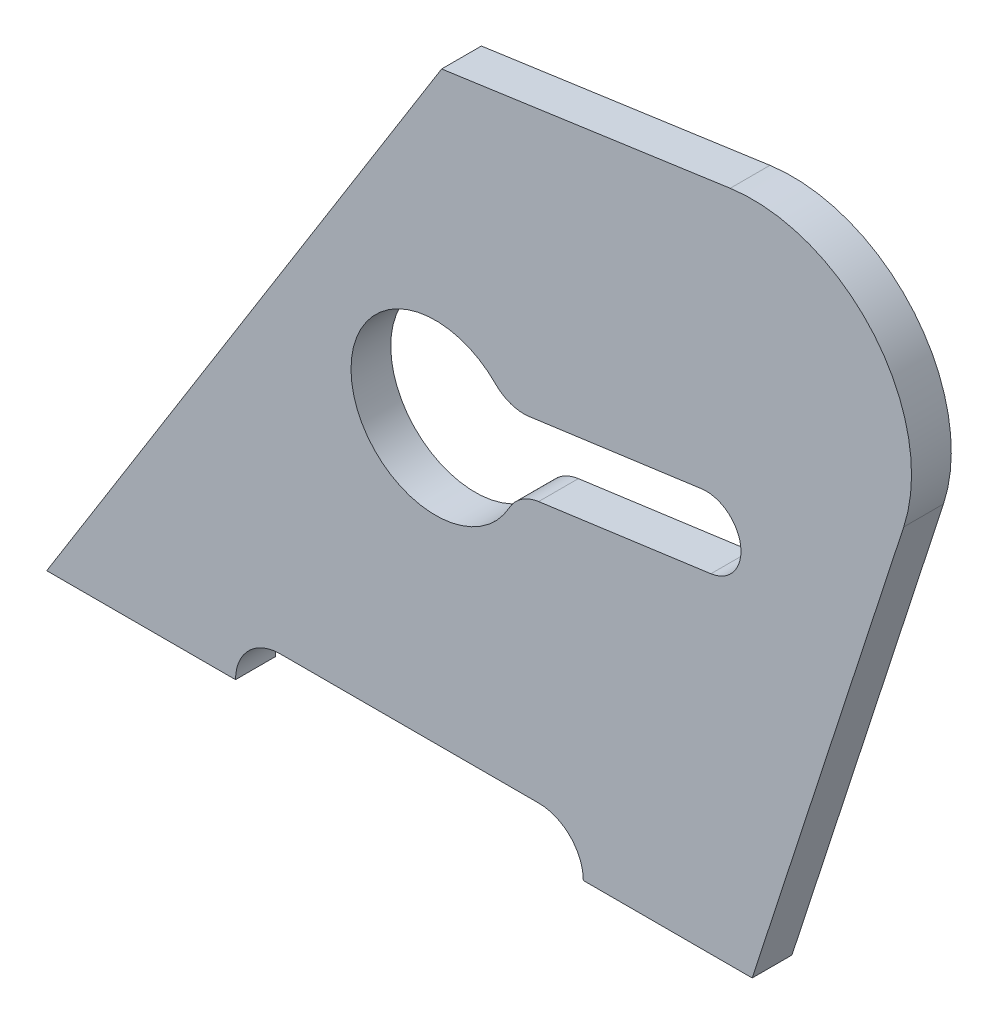
from build123d import *

# Parameters (mm, degrees)
BOSS_EXTRUDE1_DEPTH = 8


with BuildPart() as part:
    # Sketch1 → Boss-Extrude1 (new body)
    with BuildSketch(Plane.XY):
        with BuildLine():
            Line((0, 0), (79.487889635, 127.207214423))
            Line((79.487889635, 127.207214423), (137.573015724, 135.451290736))
            ThreePointArc((137.573015724, 135.451290736), (166.569139078, 124.354715336), (172.50354814, 93.880267937))
            Line((172.50354814, 93.880267937), (142, 0))
            Line((142, 0), (108, 0))
            ThreePointArc((108, 0), (105.363961031, 6.363961031), (99, 9))
            Line((99, 9), (47, 9))
            ThreePointArc((47, 9), (40.636038969, 6.363961031), (38, 0))
            Line((38, 0), (0, 0))
        make_face()
        with BuildLine():
            Line((97.109133521, 75.428206388), (131.785075785, 80.179945877))
            ThreePointArc((131.785075785, 80.179945877), (139.670612135, 74.195105322), (133.68577158, 66.309568971))
            Line((133.68577158, 66.309568971), (99.009829317, 61.557829483))
            ThreePointArc((99.009829317, 61.557829483), (95.579909698, 60.235342824), (93.103530342, 57.518568112))
            ThreePointArc((93.103530342, 57.518568112), (61.402056741, 63.469750476), (90.33394504, 77.729688746))
            ThreePointArc((90.33394504, 77.729688746), (93.449886138, 75.779245046), (97.109133521, 75.428206388))
        make_face(mode=Mode.SUBTRACT)
    extrude(amount=BOSS_EXTRUDE1_DEPTH)


solid = part.part
